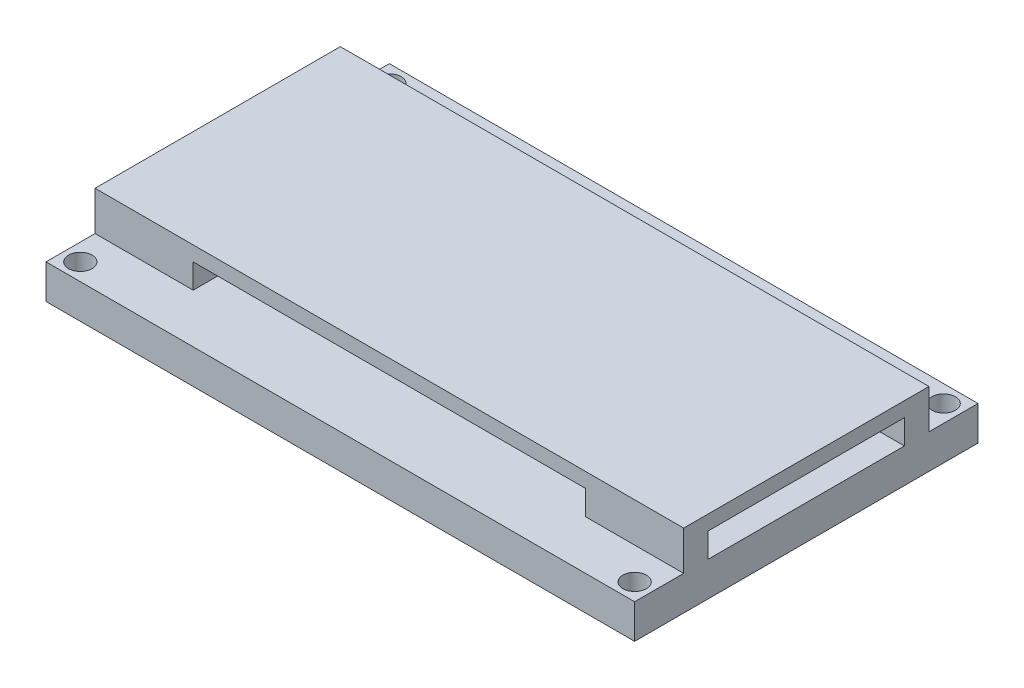
from build123d import *

# Parameters (mm, degrees)
CROQUIS1_W                   = 120
CROQUIS1_H                   = 70
SALIENTE_EXTRUIR1_DEPTH      = 7
TALADRO_DE_MARGEN_PARA_M41_D = 4.8
CROQUIS8_W                   = 120
CROQUIS8_H                   = 5
SALIENTE_EXTRUIR2_DEPTH      = 5
CROQUIS9_W                   = 120
CROQUIS9_H                   = 50
SALIENTE_EXTRUIR3_DEPTH      = 3
CROQUIS10_W                  = 80
CROQUIS10_H                  = 5
CORTAR_EXTRUIR1_DEPTH        = 87.168439698


with BuildPart() as part:
    # Croquis1 → Saliente-Extruir1 (new body)
    with BuildSketch(Plane(origin=(0, 0, 0), x_dir=(1, 0, 0), z_dir=(0, 1, 0))):
        Rectangle(CROQUIS1_W, CROQUIS1_H)
    extrude(amount=SALIENTE_EXTRUIR1_DEPTH)

    # Taladro de margen para M41 (through all)
    with Locations(Plane(origin=(0, 7, 0), x_dir=(1, 0, 0), z_dir=(0, 1, 0))):
        with Locations((56.5, 31.5), (56.5, -31.5), (-56.5, -31.5), (-56.5, 31.5)):
            Hole(TALADRO_DE_MARGEN_PARA_M41_D / 2)

    # Croquis8 → Saliente-Extruir2 (add)
    with BuildSketch(Plane(origin=(0, 7, 0), x_dir=(1, 0, 0), z_dir=(0, 1, 0))):
        with Locations((0, 22.5)):
            Rectangle(CROQUIS8_W, CROQUIS8_H)
        with Locations((0, -22.5)):
            Rectangle(CROQUIS8_W, CROQUIS8_H)
    extrude(amount=SALIENTE_EXTRUIR2_DEPTH)

    # Croquis9 → Saliente-Extruir3 (add)
    with BuildSketch(Plane(origin=(0, 12, 0), x_dir=(1, 0, 0), z_dir=(0, 1, 0))):
        Rectangle(CROQUIS9_W, CROQUIS9_H)
    extrude(amount=SALIENTE_EXTRUIR3_DEPTH)

    # Croquis10 → Cortar-Extruir1 (cut, through all)
    with BuildSketch(Plane.XY.offset(25)):
        with Locations((0, 9.5)):
            Rectangle(CROQUIS10_W, CROQUIS10_H)
    extrude(amount=-CORTAR_EXTRUIR1_DEPTH, mode=Mode.SUBTRACT)


solid = part.part
